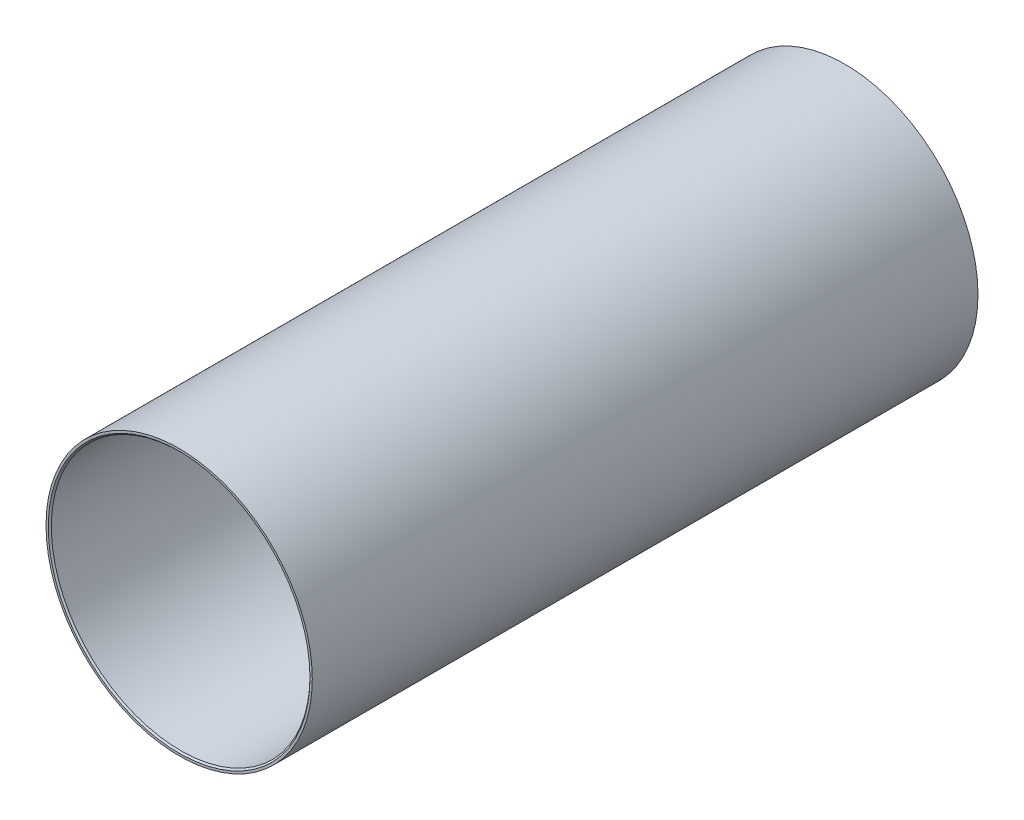
from build123d import *

# Parameters (mm, degrees)
SKETCH2_R           = 17.5
SKETCH2_R_2         = 17
BOSS_EXTRUDE1_DEPTH = 87.5
CHAMFER1_SIZE       = 0.2


with BuildPart() as part:
    # Sketch2 → Boss-Extrude1 (new body)
    with BuildSketch(Plane.XY):
        Circle(SKETCH2_R)
        Circle(SKETCH2_R_2, mode=Mode.SUBTRACT)
    extrude(amount=BOSS_EXTRUDE1_DEPTH)

    # Chamfer1
    chamfer1_edges = [part.edges().sort_by_distance(p)[0] for p in [
        (-17, 0, 0),
        (-17, 0, 87.5),
    ]]
    chamfer(chamfer1_edges, length=CHAMFER1_SIZE)


solid = part.part
